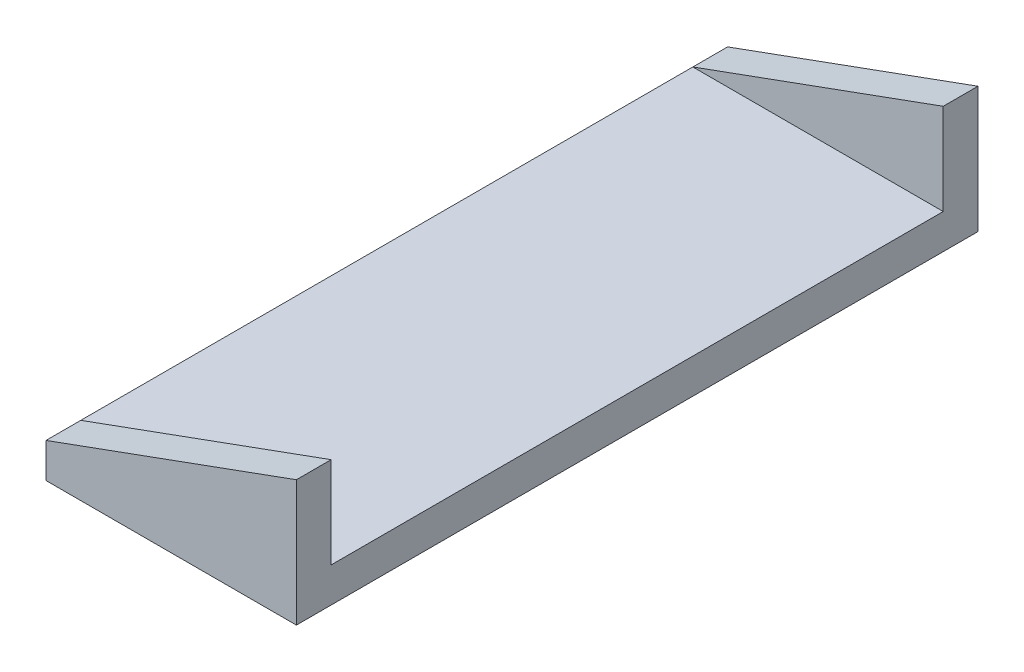
from build123d import *

# Parameters (mm, degrees)
SKETCH1_W           = 457.2
SKETCH1_H           = 1244.6
BOSS_EXTRUDE1_DEPTH = 63.5
SKETCH4_W           = 457.2
SKETCH4_H           = 63.5
BOSS_EXTRUDE2_DEPTH = 266.7
CUT_EXTRUDE7_DEPTH  = 100.076


with BuildPart() as part:
    # Sketch1 → Boss-Extrude1 (new body)
    with BuildSketch(Plane(origin=(0, 0, 0), x_dir=(1, 0, 0), z_dir=(0, 1, 0))):
        with Locations((228.6, 622.3)):
            Rectangle(SKETCH1_W, SKETCH1_H)
    extrude(amount=BOSS_EXTRUDE1_DEPTH)

    # Sketch4 → Boss-Extrude2 (add)
    with BuildSketch(Plane(origin=(0, 63.5, 0), x_dir=(1, 0, 0), z_dir=(0, 1, 0))):
        with Locations((228.6, 1212.85)):
            Rectangle(SKETCH4_W, SKETCH4_H)
    boss_extrude2 = extrude(amount=BOSS_EXTRUDE2_DEPTH)

    # Mirror7: Boss-Extrude2 across plane
    add(boss_extrude2.mirror(Plane(origin=(0, 0, -622.3), x_dir=(1, 0, 0), z_dir=(0, 0, -1))))

    # Sketch11 → Cut-Extrude7 (cut)
    with BuildSketch(Plane.XY.offset(-1181.1)):
        Polygon((0, 63.5), (0, 330.2), (457.2, 330.2), (457.2, 229.907191107), align=None)
    cut_extrude7 = extrude(amount=-CUT_EXTRUDE7_DEPTH, mode=Mode.SUBTRACT)

    # Mirror8: Cut-Extrude7 across plane
    add(cut_extrude7.mirror(Plane(origin=(0, 0, -622.3), x_dir=(1, 0, 0), z_dir=(0, 0, -1))), mode=Mode.SUBTRACT)


solid = part.part
